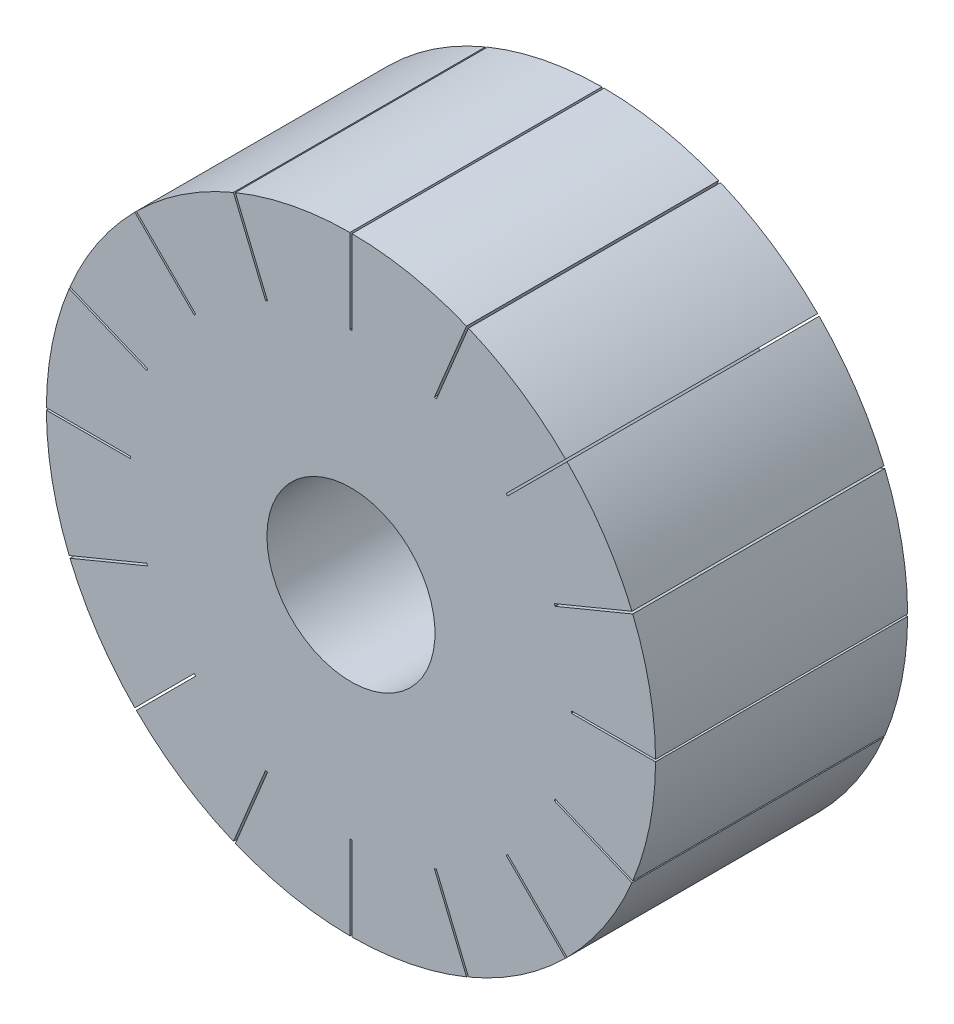
from build123d import *

# Parameters (mm, degrees)
ESQUISSE1_W                  = 12
ESQUISSE1_H                  = 10.5
ESQUISSE2_W                  = 0.1
ESQUISSE2_H                  = 4
ENL_V_MAT_EXTRU_2_DEPTH      = 24.759208741
R_P_TITION_CIRCULAIRE1_COUNT = 16


with BuildPart() as part:
    # Esquisse1 → Révolution1 (revolve)
    with BuildSketch(Plane(origin=(0, 0, 0), x_dir=(0, 0, -1), z_dir=(1, 0, 0))):
        with Locations((-6, 9.25)):
            Rectangle(ESQUISSE1_W, ESQUISSE1_H)
    revolve(axis=Axis((0, 0, 0), (0, 0, 1)))

    # Esquisse2 → Enlèv. mat.-Extru.2 (cut, through all)
    with BuildSketch(Plane.XY):
        with Locations((0, 12.5)):
            Rectangle(ESQUISSE2_W, ESQUISSE2_H)
    enl_v_mat_extru_2 = extrude(amount=ENL_V_MAT_EXTRU_2_DEPTH, mode=Mode.SUBTRACT)

    # Répétition circulaire1: Enlèv. mat.-Extru.2 ×16 about axis
    r_p_tition_circulaire1_axis = Axis((0, 0, 0), (0, 0, 1))
    for i in range(1, R_P_TITION_CIRCULAIRE1_COUNT):
        add(enl_v_mat_extru_2.rotate(r_p_tition_circulaire1_axis, i * 360 / R_P_TITION_CIRCULAIRE1_COUNT), mode=Mode.SUBTRACT)


solid = part.part
